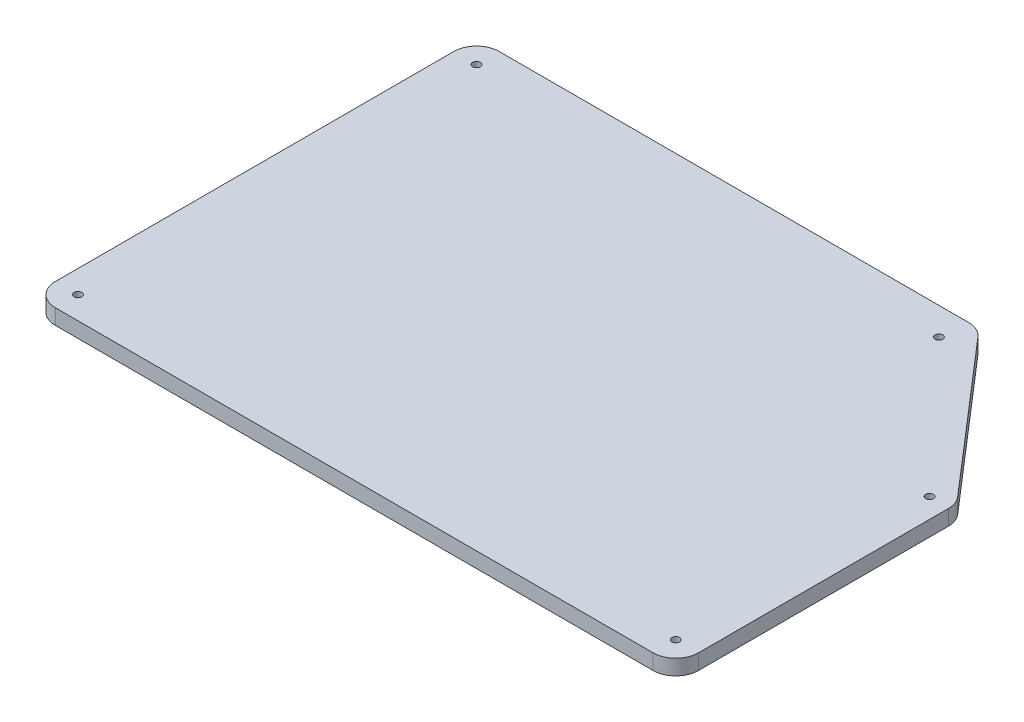
from build123d import *

# Parameters (mm, degrees)
SKETCH_2_R      = 1.25
EXTRUDE_1_DEPTH = 5


with BuildPart() as part:
    # 草图2 → 凸台-拉伸1 (new body)
    with BuildSketch(Plane(origin=(0, 0, 0), x_dir=(1, 0, 0), z_dir=(0, 1, 0))):
        with BuildLine():
            Line((-119.131169622, 57.908224798), (34.013330694, 57.908224798))
            ThreePointArc((34.013330694, 57.908224798), (37.09334763, 57.236783015), (39.614431575, 55.344304711))
            Line((39.614431575, 55.344304711), (81.469931259, 6.86767066))
            ThreePointArc((81.469931259, 6.86767066), (82.804540382, 4.611499029), (83.268830378, 2.031590747))
            Line((83.268830378, 2.031590747), (83.268830378, -79.491775202))
            ThreePointArc((83.268830378, -79.491775202), (81.101420559, -84.724365382), (75.868830378, -86.891775202))
            Line((75.868830378, -86.891775202), (-119.131169622, -86.891775202))
            ThreePointArc((-119.131169622, -86.891775202), (-124.363759802, -84.724365382), (-126.531169622, -79.491775202))
            Line((-126.531169622, -79.491775202), (-126.531169622, 50.508224798))
            ThreePointArc((-126.531169622, 50.508224798), (-124.363759802, 55.740814979), (-119.131169622, 57.908224798))
        make_face()
        with Locations(Location((76.810606689, 2.381907658, 0), (0, 0, 270))):
            Circle(SKETCH_2_R, mode=Mode.SUBTRACT)
        with Locations(Location((33.291419632, 48.931148856, 0), (0, 0, 270))):
            Circle(SKETCH_2_R, mode=Mode.SUBTRACT)
        with Locations(Location((-119.131169622, 50.508224798, 0), (0, 0, 270))):
            Circle(SKETCH_2_R, mode=Mode.SUBTRACT)
        with Locations(Location((-119.131169622, -79.491775202, 0), (0, 0, 270))):
            Circle(SKETCH_2_R, mode=Mode.SUBTRACT)
        with Locations(Location((75.868830378, -79.491775202, 0), (0, 0, 270))):
            Circle(SKETCH_2_R, mode=Mode.SUBTRACT)
    extrude(amount=EXTRUDE_1_DEPTH)


solid = part.part
